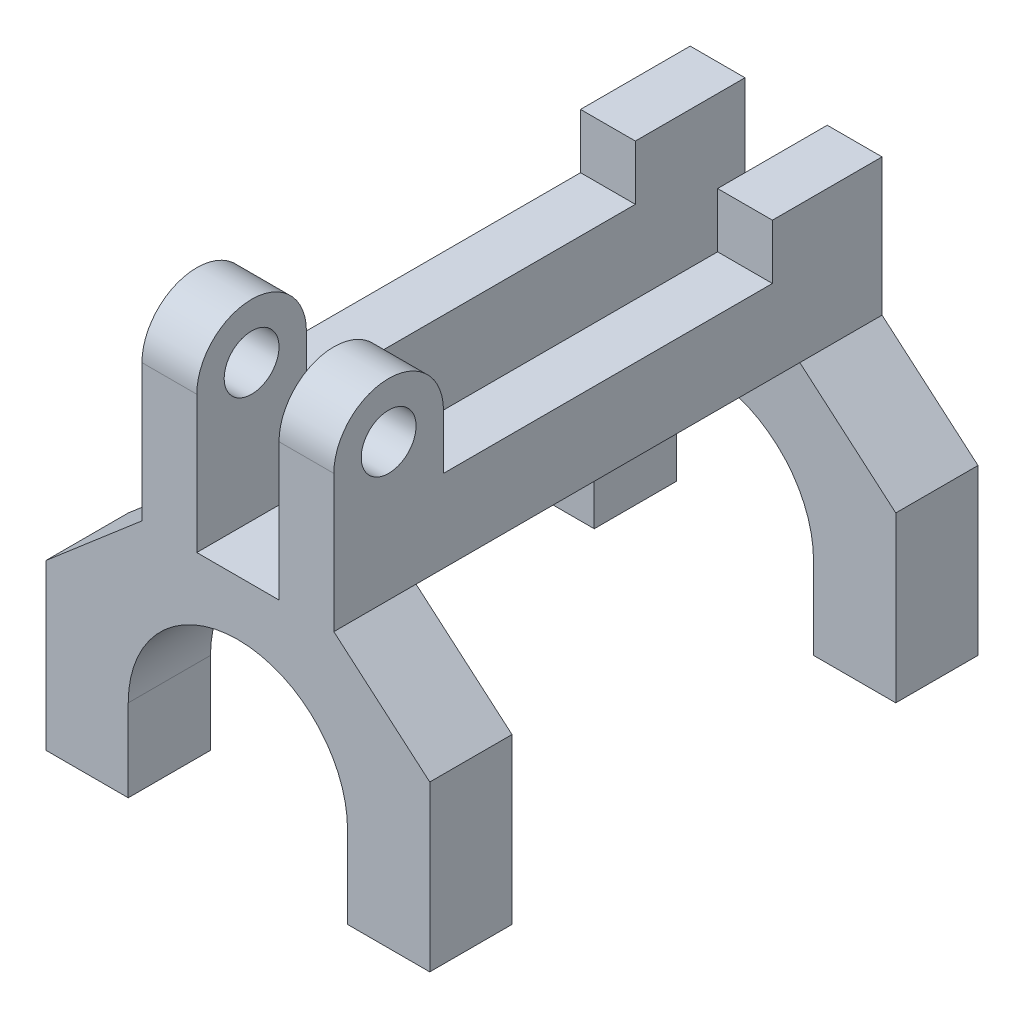
from build123d import *

# Parameters (mm, degrees)
BOSS_EXTRUDE1_DEPTH = 127
SKETCH5_W           = 88.9
SKETCH5_H           = 38.1
SKETCH5_H_2         = 19.05
CUT_EXTRUDE1_DEPTH  = 127
CUT_EXTRUDE3_DEPTH  = 127
SKETCH10_R          = 6.35
CUT_EXTRUDE4_DEPTH  = 127
SKETCH11_W          = 19.05
SKETCH11_H          = 88.9
CUT_EXTRUDE5_DEPTH  = 127


with BuildPart() as part:
    # Sketch3 → Boss-Extrude1 (new body)
    with BuildSketch(Plane.XY):
        with BuildLine():
            Line((-34.959538075, 16.727455232), (-15.909538075, 16.727455232))
            Line((-15.909538075, 16.727455232), (-15.909538075, 35.777455232))
            ThreePointArc((-15.909538075, 35.777455232), (9.490461925, 61.177455232), (34.890461925, 35.777455232))
            Line((34.890461925, 35.777455232), (34.890461925, 16.727455232))
            Line((34.890461925, 16.727455232), (53.940461925, 16.727455232))
            Line((53.940461925, 16.727455232), (53.940461925, 54.827455232))
            Line((53.940461925, 54.827455232), (31.715461925, 73.877455232))
            Line((31.715461925, 73.877455232), (31.715461925, 118.327455232))
            Line((31.715461925, 118.327455232), (19.015461925, 118.327455232))
            Line((19.015461925, 118.327455232), (19.015461925, 73.877455232))
            Line((19.015461925, 73.877455232), (-0.034538075, 73.877455232))
            Line((-0.034538075, 73.877455232), (-0.034538075, 118.327455232))
            Line((-0.034538075, 118.327455232), (-12.734538075, 118.327455232))
            Line((-12.734538075, 118.327455232), (-12.734538075, 73.877455232))
            Line((-12.734538075, 73.877455232), (-34.959538075, 54.827455232))
            Line((-34.959538075, 54.827455232), (-34.959538075, 16.727455232))
        make_face()
    extrude(amount=BOSS_EXTRUDE1_DEPTH)

    # Sketch5 → Cut-Extrude1 (cut)
    with BuildSketch(Plane(origin=(53.940461925, 0, 0), x_dir=(0, 0, -1), z_dir=(1, 0, 0))):
        with Locations((-63.5, 35.777455232)):
            Rectangle(SKETCH5_W, SKETCH5_H)
        with Locations((-63.5, 64.352455232)):
            Rectangle(SKETCH5_W, SKETCH5_H_2)
    extrude(amount=-CUT_EXTRUDE1_DEPTH, mode=Mode.SUBTRACT)

    # Sketch9 → Cut-Extrude3 (cut)
    with BuildSketch(Plane(origin=(31.715461925, 0, 0), x_dir=(0, 0, -1), z_dir=(1, 0, 0))):
        Polygon((0, 118.327455232), (-41.314900114, 118.327455232), (-101.6, 118.327455232), (-101.6, 92.927455232), (-25.4, 92.927455232), (-25.4, 105.627455232), (0, 105.627455232), align=None)
    extrude(amount=-CUT_EXTRUDE3_DEPTH, mode=Mode.SUBTRACT)

    # Sketch10 → Cut-Extrude4 (cut)
    with BuildSketch(Plane(origin=(31.715461925, 0, 0), x_dir=(0, 0, -1), z_dir=(1, 0, 0))):
        with BuildLine():
            Line((-101.6, 118.327455232), (-114.3, 118.327455232))
            ThreePointArc((-114.3, 118.327455232), (-105.319743879, 114.607711353), (-101.6, 105.627455232))
            Line((-101.6, 105.627455232), (-101.6, 118.327455232))
        make_face()
        with Locations((-114.3, 105.627455232)):
            Circle(SKETCH10_R)
        with BuildLine():
            ThreePointArc((-127, 105.627455232), (-123.280256121, 114.607711353), (-114.3, 118.327455232))
            Line((-114.3, 118.327455232), (-127, 118.327455232))
            Line((-127, 118.327455232), (-127, 105.627455232))
        make_face()
    extrude(amount=-CUT_EXTRUDE4_DEPTH, mode=Mode.SUBTRACT)

    # Sketch11 → Cut-Extrude5 (cut)
    with BuildSketch(Plane(origin=(0, 73.877455232, 0), x_dir=(1, 0, 0), z_dir=(0, 1, 0))):
        with Locations((9.490461925, -63.5)):
            Rectangle(SKETCH11_W, SKETCH11_H)
    extrude(amount=-CUT_EXTRUDE5_DEPTH, mode=Mode.SUBTRACT)


solid = part.part
